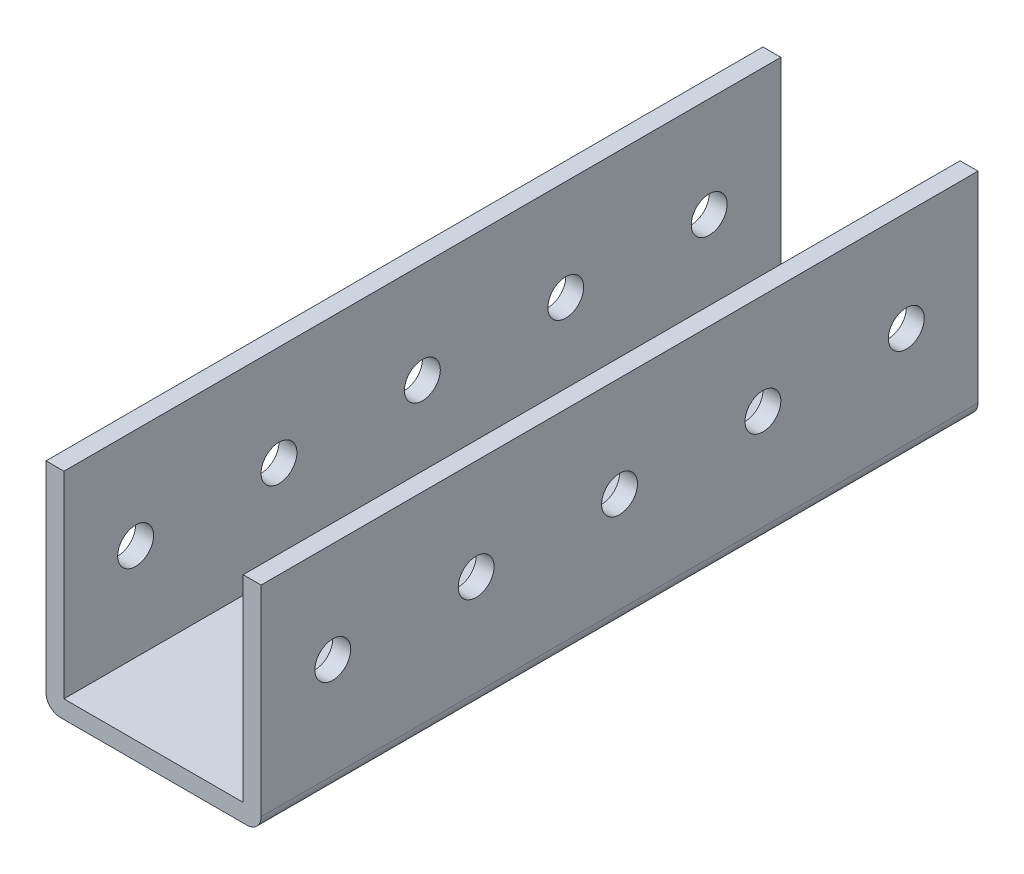
from build123d import *

# Parameters (mm, degrees)
SKETCH2_W           = 38.1
SKETCH2_H           = 127
BOSS_EXTRUDE1_DEPTH = 38.1
SKETCH3_W           = 31.75
SKETCH3_H           = 34.925
CUT_EXTRUDE1_DEPTH  = 406.4
FILLET1_R           = 2.54
SKETCH4_R           = 3.175
CUT_EXTRUDE2_DEPTH  = 50.8


with BuildPart() as part:
    # Sketch2 → Boss-Extrude1 (new body)
    with BuildSketch(Plane(origin=(0, 0, 0), x_dir=(1, 0, 0), z_dir=(0, 1, 0))):
        Rectangle(SKETCH2_W, SKETCH2_H)
    extrude(amount=BOSS_EXTRUDE1_DEPTH)

    # Sketch3 → Cut-Extrude1 (cut)
    with BuildSketch(Plane.XY.offset(63.5)):
        with Locations((0, 20.6375)):
            Rectangle(SKETCH3_W, SKETCH3_H)
    extrude(amount=-CUT_EXTRUDE1_DEPTH, mode=Mode.SUBTRACT)

    # Fillet1
    fillet1_edges = [part.edges().sort_by_distance(p)[0] for p in [
        (-19.05, 0, 0),
        (19.05, 0, 0),
    ]]
    fillet(fillet1_edges, radius=FILLET1_R)

    # Sketch4 → Cut-Extrude2 (cut)
    with BuildSketch(Plane(origin=(19.05, 0, 0), x_dir=(0, 0, -1), z_dir=(1, 0, 0))):
        with Locations((-50.8, 20.32)):
            Circle(SKETCH4_R)
        with Locations((-25.4, 20.32)):
            Circle(SKETCH4_R)
        with Locations((0, 20.32)):
            Circle(SKETCH4_R)
        with Locations((25.4, 20.32)):
            Circle(SKETCH4_R)
        with Locations((50.8, 20.32)):
            Circle(SKETCH4_R)
    extrude(amount=-CUT_EXTRUDE2_DEPTH, mode=Mode.SUBTRACT)


solid = part.part
